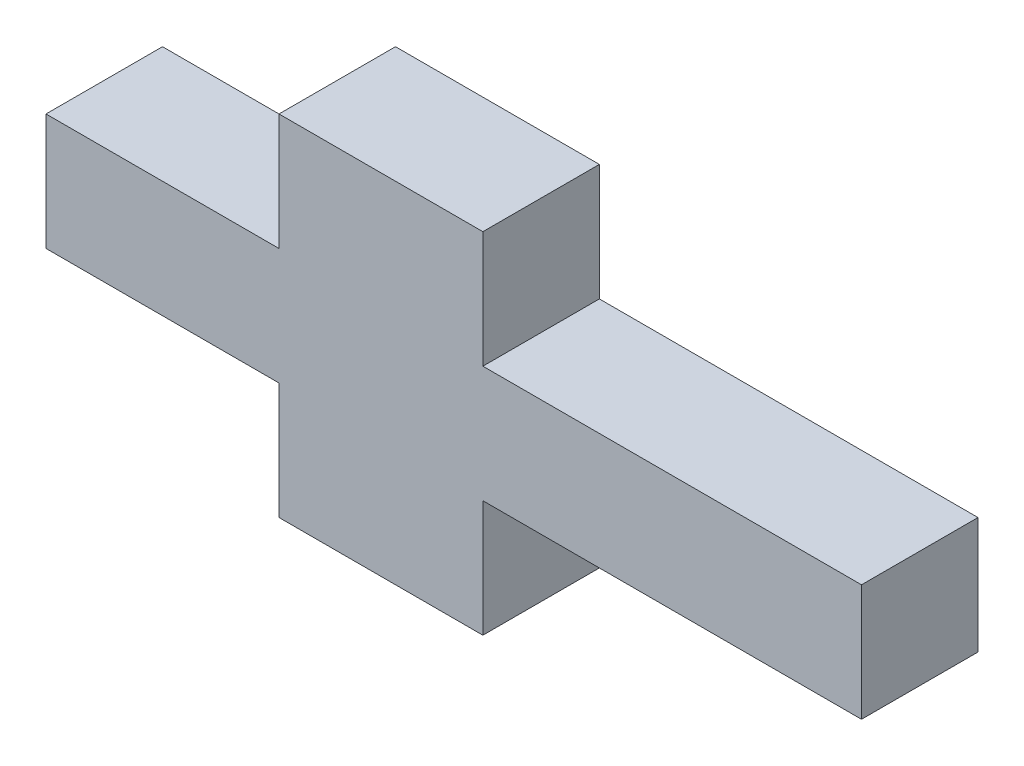
from build123d import *

# Parameters (mm, degrees)
ESTRUSIONE_ESTRUSIONE1_DEPTH = 4


with BuildPart() as part:
    # Schizzo1 → Estrusione-Estrusione1 (new body)
    with BuildSketch(Plane.XY):
        Polygon((0, 0), (0, 4), (8, 4), (8, 8), (15, 8), (15, 4), (28, 4), (28, 0), (15, 0), (15, -4), (8, -4), (8, 0), align=None)
    extrude(amount=ESTRUSIONE_ESTRUSIONE1_DEPTH)


solid = part.part
